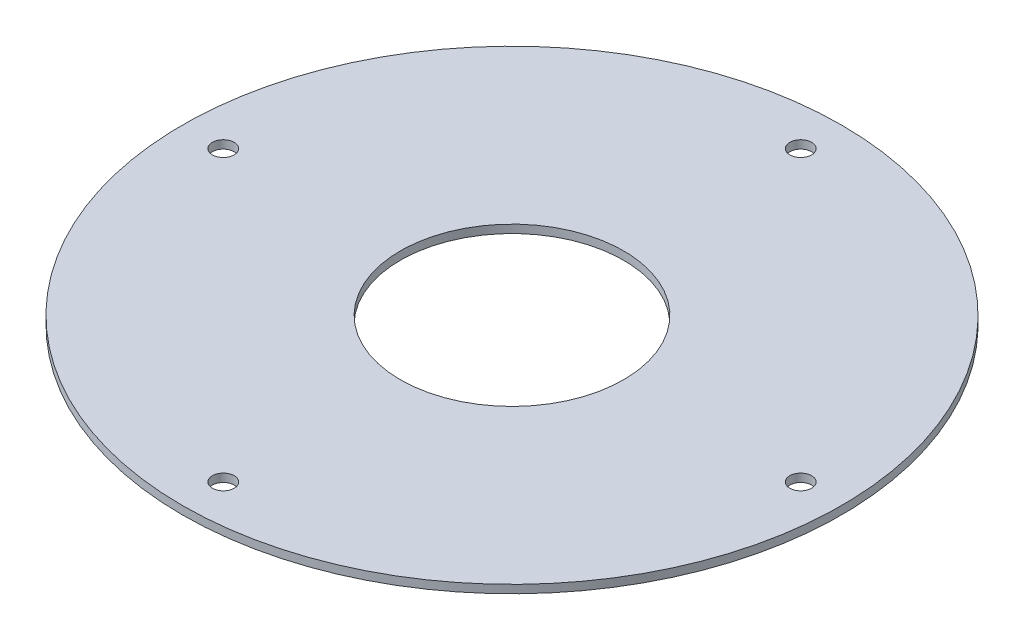
from build123d import *

# Parameters (mm, degrees)
SKETCH1_R           = 60.5
SKETCH1_R_2         = 20.5
BOSS_EXTRUDE1_DEPTH = 1.5
SKETCH2_R           = 2
CUT_EXTRUDE1_DEPTH  = 86.573068193


with BuildPart() as part:
    # Sketch1 → Boss-Extrude1 (new body)
    with BuildSketch(Plane(origin=(0, 0, 0), x_dir=(1, 0, 0), z_dir=(0, 1, 0))):
        with Locations(Location((0, 0, 0), (0, 0, 270))):
            Circle(SKETCH1_R)
        with Locations(Location((0, 0, 0), (0, 0, 270))):
            Circle(SKETCH1_R_2, mode=Mode.SUBTRACT)
    extrude(amount=BOSS_EXTRUDE1_DEPTH)

    # Sketch2 → Cut-Extrude1 (cut, through all)
    with BuildSketch(Plane(origin=(0, 1.5, 0), x_dir=(1, 0, 0), z_dir=(0, 1, 0))):
        with Locations(Location((0, 53, 0), (0, 0, 270))):
            Circle(SKETCH2_R)
        with Locations(Location((53, 0, 0), (0, 0, 270))):
            Circle(SKETCH2_R)
        with Locations(Location((0, -53, 0), (0, 0, 270))):
            Circle(SKETCH2_R)
        with Locations(Location((-53, 0, 0), (0, 0, 270))):
            Circle(SKETCH2_R)
    extrude(amount=-CUT_EXTRUDE1_DEPTH, mode=Mode.SUBTRACT)


solid = part.part
